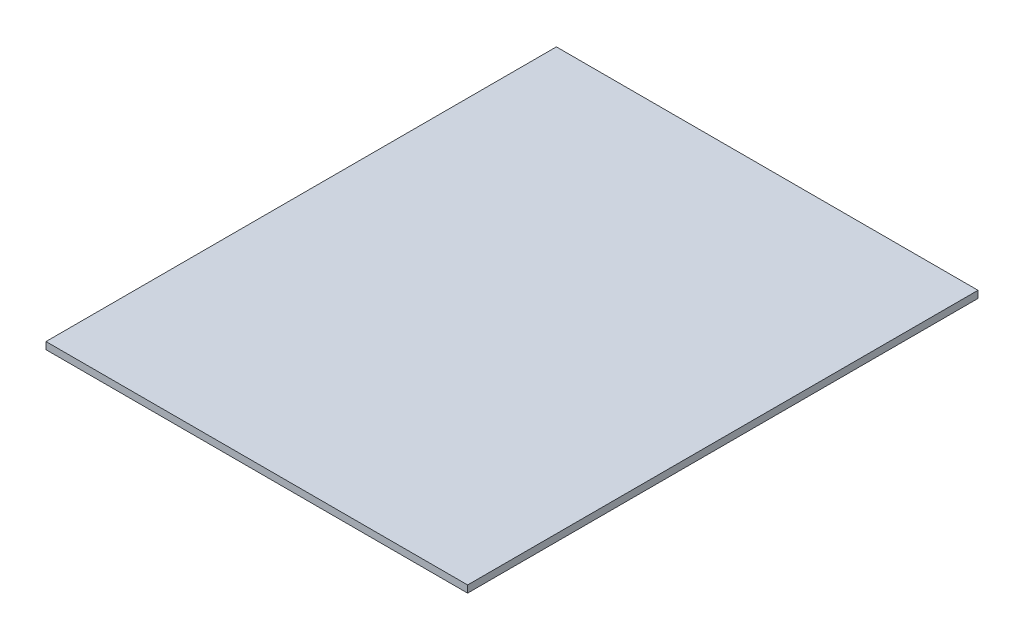
from build123d import *

# Parameters (mm, degrees)
SKETCH1_W           = 95
SKETCH1_H           = 115
BOSS_EXTRUDE1_DEPTH = 1.6


with BuildPart() as part:
    # Sketch1 → Boss-Extrude1 (new body)
    with BuildSketch(Plane(origin=(0, 0, 0), x_dir=(1, 0, 0), z_dir=(0, 1, 0))):
        with Locations((47.5, 57.5)):
            Rectangle(SKETCH1_W, SKETCH1_H)
    extrude(amount=BOSS_EXTRUDE1_DEPTH)


solid = part.part
